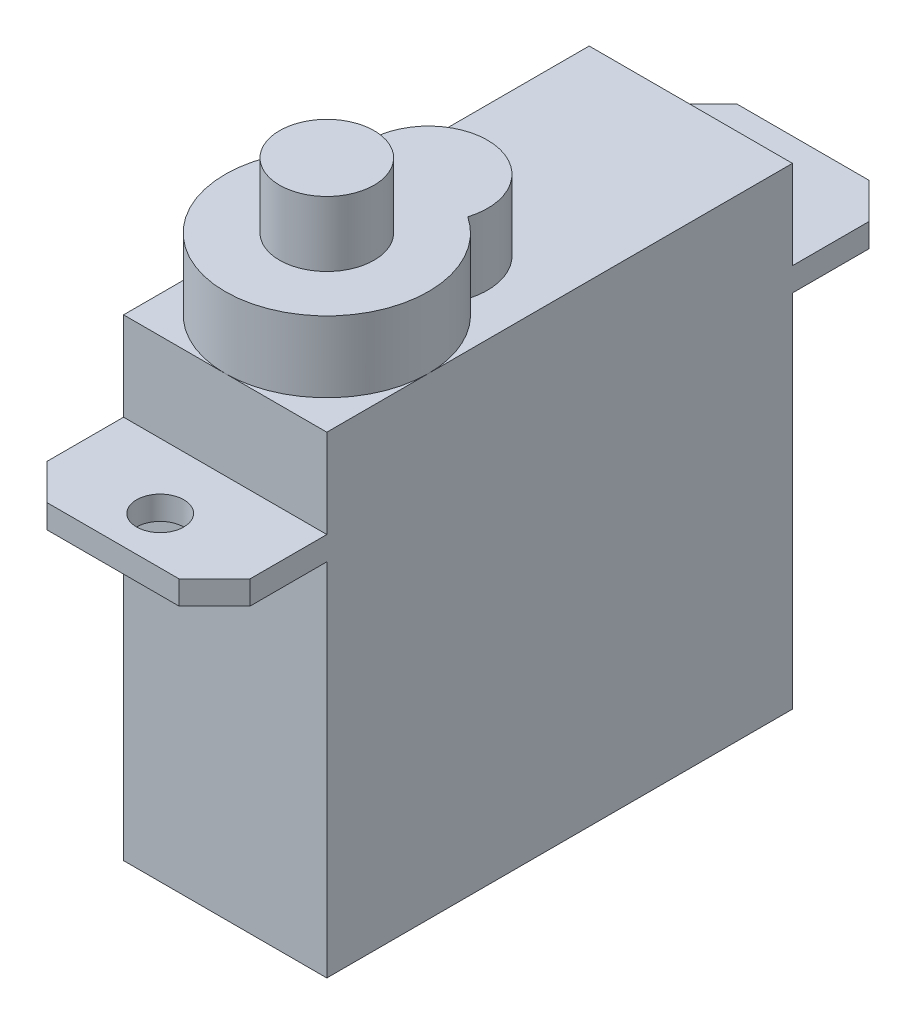
from build123d import *

# Parameters (mm, degrees)
BOSS_EXTRUDE1_DEPTH = 8.6
BOSS_EXTRUDE2_DEPTH = 3
SKETCH3_R           = 2
BOSS_EXTRUDE3_DEPTH = 2.75
CUT_EXTRUDE1_REACH  = 25.477
SKETCH4_R           = 1
CHAMFER1_SIZE       = 1.5


with BuildPart() as part:
    # Sketch1 → Boss-Extrude1 (new body)
    with BuildSketch(Plane(origin=(0, 0, 0), x_dir=(0, 0, -1), z_dir=(1, 0, 0))):
        Polygon((9.85, -3.75), (14.6, -3.75), (14.6, -4.75), (9.85, -4.75), (9.85, -20), (-9.85, -20), (-9.85, -4.75), (-14.6, -4.75), (-14.6, -3.75), (-9.85, -3.75), (-9.85, 0), (9.85, 0), align=None)
    extrude(amount=BOSS_EXTRUDE1_DEPTH)

    # Sketch2 → Boss-Extrude2 (add)
    with BuildSketch(Plane(origin=(0, 0, 0), x_dir=(1, 0, 0), z_dir=(0, 1, 0))):
        with BuildLine():
            ThreePointArc((1.907962607, -1.976744186), (4.3, -9.85), (6.692037393, -1.976744186))
            ThreePointArc((6.692037393, -1.976744186), (4.3, 1.25), (1.907962607, -1.976744186))
        make_face()
    extrude(amount=BOSS_EXTRUDE2_DEPTH)

    # Sketch3 → Boss-Extrude3 (add)
    with BuildSketch(Plane(origin=(0, 3, 0), x_dir=(1, 0, 0), z_dir=(0, 1, 0))):
        with Locations(Location((4.3, -5.55, 0), (0, 0, 270))):
            Circle(SKETCH3_R)
    extrude(amount=BOSS_EXTRUDE3_DEPTH)

    # Sketch4 → Cut-Extrude1 (cut, up to next)
    with BuildSketch(Plane(origin=(0, -3.75, 0), x_dir=(1, 0, 0), z_dir=(0, 1, 0)), mode=Mode.PRIVATE) as cut_extrude1_sk1:
        with Locations(Location((4.3, -12.6, 0), (0, 0, 270))):
            Circle(SKETCH4_R)
    cut_extrude1_tool1 = extrude(cut_extrude1_sk1.sketch, amount=-CUT_EXTRUDE1_REACH, mode=Mode.PRIVATE) & part.part
    cut_extrude1 = cut_extrude1_tool1.solids().sort_by_distance((4.3, -3.75, 12.6))[0]
    add(cut_extrude1, mode=Mode.SUBTRACT)

    # Mirror1: Cut-Extrude1 across plane
    add(cut_extrude1.mirror(Plane.XY), mode=Mode.SUBTRACT)

    # Chamfer1
    chamfer1_edges = [part.edges().sort_by_distance(p)[0] for p in [
        (8.6, -4.25, 14.6),
        (0, -4.25, -14.6),
        (0, -4.25, 14.6),
        (8.6, -4.25, -14.6),
    ]]
    chamfer(chamfer1_edges, length=CHAMFER1_SIZE)


solid = part.part
